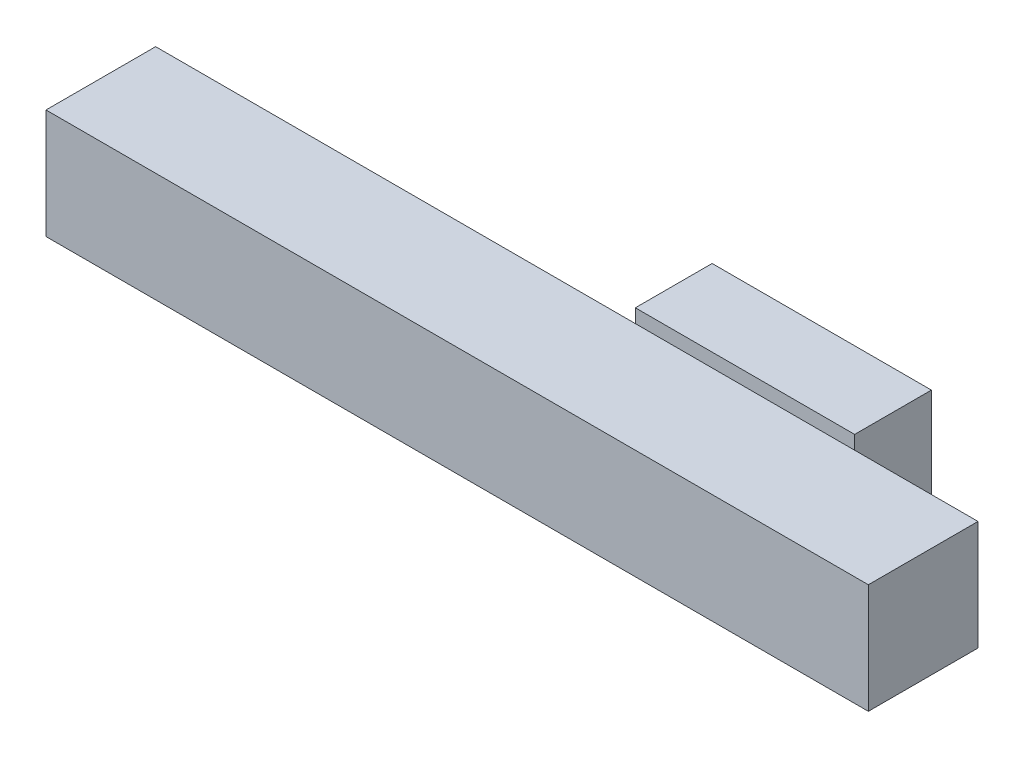
from build123d import *

# Parameters (mm, degrees)
SKETCH1_W           = 80
SKETCH1_H           = 49
BOSS_EXTRUDE1_DEPTH = 28
SKETCH2_W           = 300
SKETCH2_H           = 40
BOSS_EXTRUDE2_DEPTH = 40


with BuildPart() as part:
    # Sketch1 → Boss-Extrude1 (new body)
    with BuildSketch(Plane.XY):
        Rectangle(SKETCH1_W, SKETCH1_H)
    extrude(amount=BOSS_EXTRUDE1_DEPTH)

    # Sketch2 → Boss-Extrude2 (add)
    with BuildSketch(Plane.XY.offset(28)):
        with Locations((-65, -0.5)):
            Rectangle(SKETCH2_W, SKETCH2_H)
    extrude(amount=BOSS_EXTRUDE2_DEPTH)


solid = part.part
